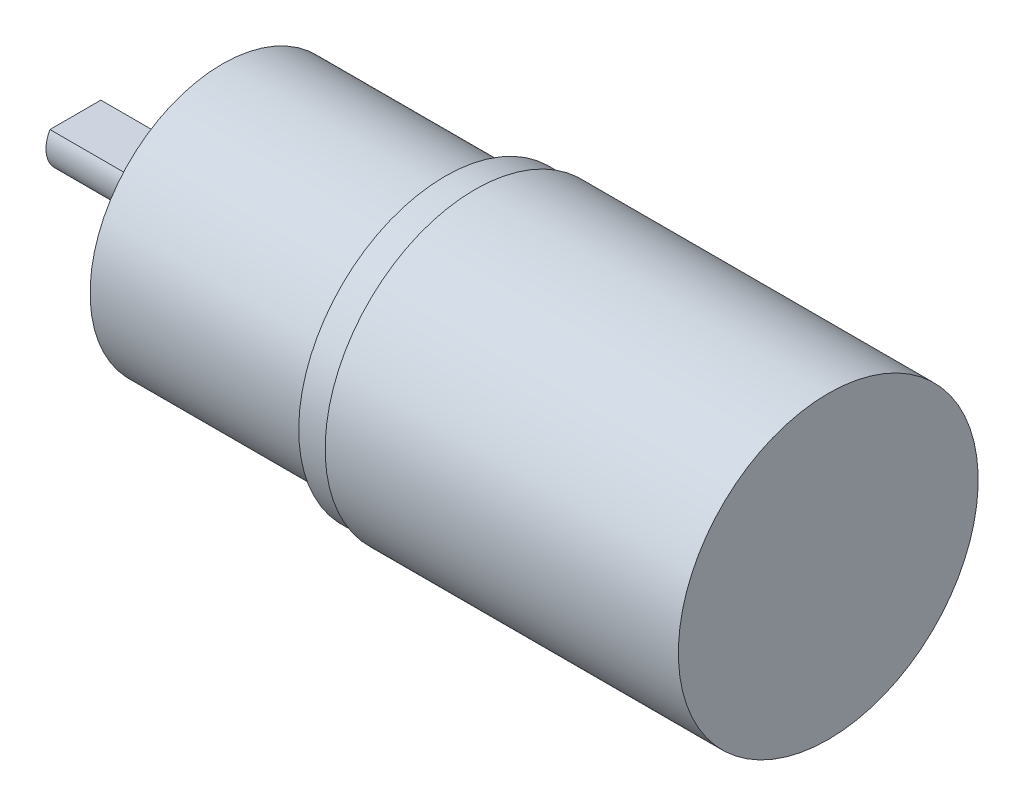
from build123d import *

# Parameters (mm, degrees)
FORO_3_0_3_2_D           = 3
FORO_3_0_3_2_DEPTH       = 8
FORO_3_0_3_2_TIP         = 0.901290929
SCHIZZO6_W               = 14.665621526
SCHIZZO6_H               = 2.346880268
TAGLIO_ESTRUSIONE1_DEPTH = 15


with BuildPart() as part:
    # Schizzo1 → Rivoluzione1 (revolve)
    with BuildSketch(Plane.XY):
        Polygon((15.282220449, 23.830923985), (-32.775254634, 23.830923985), (-32.775254634, 23.35027231), (-36.85329536, 23.35027231), (-36.85329536, 21.434825278), (-67.152934439, 21.434825278), (-67.152934439, 14.434825278), (-68.917878687, 14.434825278), (-68.917878687, 9.273654429), (-69.6840575, 9.273654429), (-69.6840575, 7.434825278), (-87.152934439, 7.434825278), (-87.152934439, 3.434825278), (15.282220449, 3.434825278), align=None)
    revolve(axis=Axis((15.282220449, 3.434825278, 0), (-1, 0, 0)))

    # Foro Ø3.0 (3)-2
    with Locations(Plane.ZY.offset(67.152934439)):
        with Locations((-9.915498688, 13.350323965), (9.915498688, 13.350323965), (9.915498688, -6.48067341), (-9.915498688, -6.48067341)):
            Hole(FORO_3_0_3_2_D / 2, depth=FORO_3_0_3_2_DEPTH)
            with Locations((0, 0, -(FORO_3_0_3_2_DEPTH + FORO_3_0_3_2_TIP / 2))):  # 118° drill point
                Cone(0, FORO_3_0_3_2_D / 2, FORO_3_0_3_2_TIP, mode=Mode.SUBTRACT)

    # Schizzo6 → Taglio-Estrusione1 (cut)
    with BuildSketch(Plane.ZY.offset(87.152934439)):
        with Locations((0.422032274, 6.608265412)):
            Rectangle(SCHIZZO6_W, SCHIZZO6_H)
    extrude(amount=-TAGLIO_ESTRUSIONE1_DEPTH, mode=Mode.SUBTRACT)


solid = part.part
